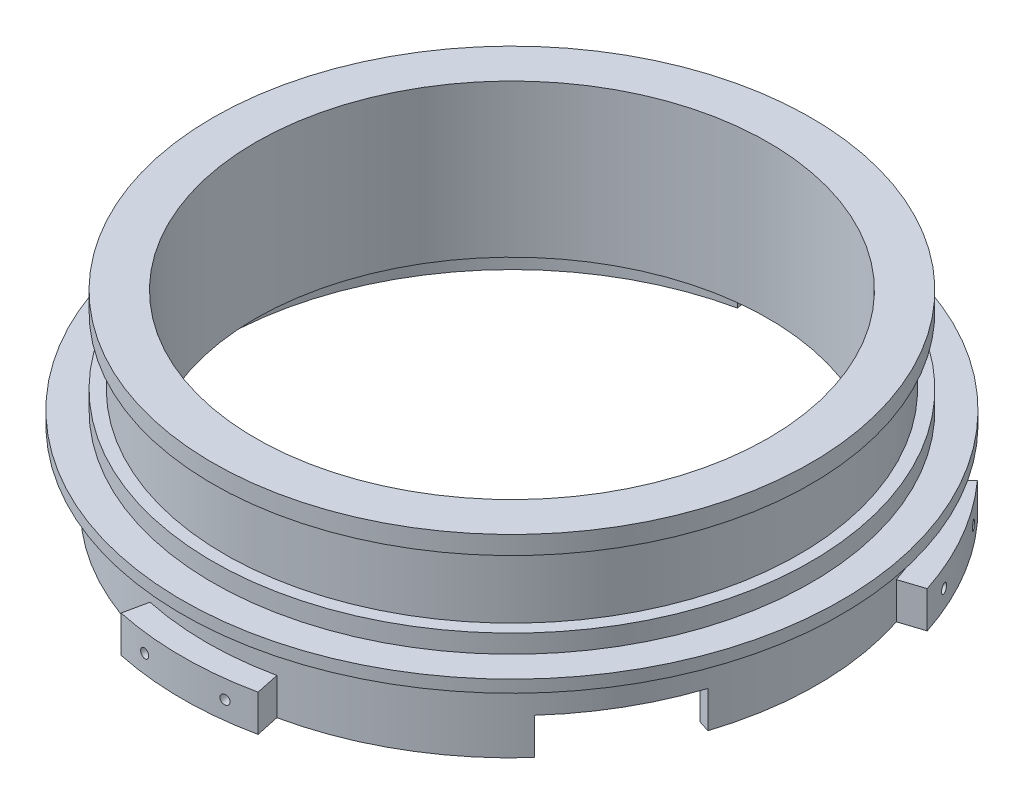
from build123d import *

# Parameters (mm, degrees)
CUT_EXTRUDE1_DEPTH                  = 6
CUT_EXTRUDE2_DEPTH                  = 6
CUT_EXTRUDE3_DEPTH                  = 6
BOSS_EXTRUDE1_DEPTH                 = 6
BOSS_EXTRUDE2_DEPTH                 = 6
BOSS_EXTRUDE3_DEPTH                 = 6
F_1_5MM_DOWEL_HOLE1_D               = 1.5
F_1_5MM_DOWEL_HOLE1_DEPTH           = 3
F_1_5MM_DOWEL_HOLE1_TIP             = 0.450645464
F_1_5MM_DOWEL_HOLE1_ON_FACE_2_D     = 1.5
F_1_5MM_DOWEL_HOLE1_ON_FACE_2_DEPTH = 3
F_1_5MM_DOWEL_HOLE1_ON_FACE_2_TIP   = 0.450645464
F_1_5MM_DOWEL_HOLE1_ON_FACE_3_D     = 1.5
F_1_5MM_DOWEL_HOLE1_ON_FACE_3_DEPTH = 3
F_1_5MM_DOWEL_HOLE1_ON_FACE_3_TIP   = 0.450645464
F_1_5MM_DOWEL_HOLE1_ON_FACE_4_D     = 1.5
F_1_5MM_DOWEL_HOLE1_ON_FACE_4_DEPTH = 3
F_1_5MM_DOWEL_HOLE1_ON_FACE_4_TIP   = 0.450645464
F_1_5MM_DOWEL_HOLE1_ON_FACE_5_D     = 1.5
F_1_5MM_DOWEL_HOLE1_ON_FACE_5_DEPTH = 3
F_1_5MM_DOWEL_HOLE1_ON_FACE_5_TIP   = 0.450645464
F_1_5MM_DOWEL_HOLE1_ON_FACE_6_D     = 1.5
F_1_5MM_DOWEL_HOLE1_ON_FACE_6_DEPTH = 3
F_1_5MM_DOWEL_HOLE1_ON_FACE_6_TIP   = 0.450645464


with BuildPart() as part:
    # Sketch1 → Revolve1 (revolve)
    with BuildSketch(Plane.XY):
        Polygon((-42, 6), (-42, 31), (-49, 31), (-49, 28), (-47, 28), (-47, 17), (-49, 17), (-49, 14), (-54, 14), (-54, 12), (-50, 12), (-50, 0), (-48, 0), (-48, 10), (-44, 10), (-44, 7), (-43, 6), align=None)
    revolve(axis=Axis((0, 15.855614973, 0), (0, -1, 0)))

    # Sketch2 → Cut-Extrude1 (cut)
    with BuildSketch(Plane.XZ):
        with BuildLine():
            Line((10.395584541, -48.907380037), (9.979761159, -46.951084835))
            ThreePointArc((9.979761159, -46.951084835), (0, -48), (-9.979761159, -46.951084835))
            Line((-9.979761159, -46.951084835), (-10.395584541, -48.907380037))
            ThreePointArc((-10.395584541, -48.907380037), (0, -50), (10.395584541, -48.907380037))
        make_face()
    extrude(amount=-CUT_EXTRUDE1_DEPTH, mode=Mode.SUBTRACT)

    # Sketch2<5> → Cut-Extrude2 (cut)
    with BuildSketch(Plane.XZ):
        with BuildLine():
            ThreePointArc((-45.650712782, 14.83281573), (-41.569219382, 24), (-35.670951623, 32.118269105))
            Line((-35.670951623, 32.118269105), (-37.157241274, 33.456530318))
            ThreePointArc((-37.157241274, 33.456530318), (-43.301270189, 25), (-47.552825815, 15.450849719))
            Line((-47.552825815, 15.450849719), (-45.650712782, 14.83281573))
        make_face()
    extrude(amount=-CUT_EXTRUDE2_DEPTH, mode=Mode.SUBTRACT)

    # Sketch2<6> → Cut-Extrude3 (cut)
    with BuildSketch(Plane.XZ):
        with BuildLine():
            Line((37.157241274, 33.456530318), (35.670951623, 32.118269105))
            ThreePointArc((35.670951623, 32.118269105), (41.569219382, 24), (45.650712782, 14.83281573))
            Line((45.650712782, 14.83281573), (47.552825815, 15.450849719))
            ThreePointArc((47.552825815, 15.450849719), (43.301270189, 25), (37.157241274, 33.456530318))
        make_face()
    extrude(amount=-CUT_EXTRUDE3_DEPTH, mode=Mode.SUBTRACT)

    # Sketch2<7> → Boss-Extrude1 (add)
    with BuildSketch(Plane.XZ):
        with BuildLine():
            ThreePointArc((47.552825815, -15.450849719), (43.301270189, -25), (37.157241274, -33.456530318))
            Line((37.157241274, -33.456530318), (40.129820576, -36.133052743))
            ThreePointArc((40.129820576, -36.133052743), (46.765371804, -27), (51.35705188, -16.686917696))
            Line((51.35705188, -16.686917696), (47.552825815, -15.450849719))
        make_face()
    extrude(amount=-BOSS_EXTRUDE1_DEPTH)

    # Sketch2<8> → Boss-Extrude2 (add)
    with BuildSketch(Plane.XZ):
        with BuildLine():
            ThreePointArc((-10.395584541, 48.907380037), (-5.226423163, 49.726094768), (0, 50))
            ThreePointArc((0, 50), (5.226423163, 49.726094768), (10.395584541, 48.907380037))
            Line((10.395584541, 48.907380037), (11.227231304, 52.81997044))
            ThreePointArc((11.227231304, 52.81997044), (0, 54), (-11.227231304, 52.81997044))
            Line((-11.227231304, 52.81997044), (-10.395584541, 48.907380037))
        make_face()
    extrude(amount=-BOSS_EXTRUDE2_DEPTH)

    # Sketch2<9> → Boss-Extrude3 (add)
    with BuildSketch(Plane.XZ):
        with BuildLine():
            Line((-40.129820576, -36.133052743), (-37.157241274, -33.456530318))
            ThreePointArc((-37.157241274, -33.456530318), (-43.301270189, -25), (-47.552825815, -15.450849719))
            Line((-47.552825815, -15.450849719), (-51.35705188, -16.686917696))
            ThreePointArc((-51.35705188, -16.686917696), (-46.765371804, -27), (-40.129820576, -36.133052743))
        make_face()
    extrude(amount=-BOSS_EXTRUDE3_DEPTH)

    # Ø1.5mm Dowel Hole1
    with Locations(Plane(origin=(6.577263108, 3, 53.597944084), x_dir=(0.992554520069, 0, -0.121801168675), z_dir=(0.121801168675, 0, 0.992554520069))):
        with Locations((0, 0)):
            Hole(F_1_5MM_DOWEL_HOLE1_D / 2, depth=F_1_5MM_DOWEL_HOLE1_DEPTH)
            with Locations((0, 0, -(F_1_5MM_DOWEL_HOLE1_DEPTH + F_1_5MM_DOWEL_HOLE1_TIP / 2))):  # 118° drill point
                Cone(0, F_1_5MM_DOWEL_HOLE1_D / 2, F_1_5MM_DOWEL_HOLE1_TIP, mode=Mode.SUBTRACT)

    # Ø1.5mm Dowel Hole1 on face 2
    with Locations(Plane(origin=(-6.584625948, 3, 53.597040041), x_dir=(0.992537723435, 0, 0.121937966023), z_dir=(-0.121937966023, 0, 0.992537723435))):
        with Locations((0, 0)):
            Hole(F_1_5MM_DOWEL_HOLE1_ON_FACE_2_D / 2, depth=F_1_5MM_DOWEL_HOLE1_ON_FACE_2_DEPTH)
            with Locations((0, 0, -(F_1_5MM_DOWEL_HOLE1_ON_FACE_2_DEPTH + F_1_5MM_DOWEL_HOLE1_ON_FACE_2_TIP / 2))):  # 118° drill point
                Cone(0, F_1_5MM_DOWEL_HOLE1_ON_FACE_2_D / 2, F_1_5MM_DOWEL_HOLE1_ON_FACE_2_TIP, mode=Mode.SUBTRACT)

    # Ø1.5mm Dowel Hole1 on face 3
    with Locations(Plane(origin=(-49.705812721, 3, -21.102895103), x_dir=(0.39079405883, 0, -0.920478138569), z_dir=(-0.920478138569, 0, -0.39079405883))):
        with Locations((-1e-09, 0)):
            Hole(F_1_5MM_DOWEL_HOLE1_ON_FACE_3_D / 2, depth=F_1_5MM_DOWEL_HOLE1_ON_FACE_3_DEPTH)
            with Locations((0, 0, -(F_1_5MM_DOWEL_HOLE1_ON_FACE_3_DEPTH + F_1_5MM_DOWEL_HOLE1_ON_FACE_3_TIP / 2))):  # 118° drill point
                Cone(0, F_1_5MM_DOWEL_HOLE1_ON_FACE_3_D / 2, F_1_5MM_DOWEL_HOLE1_ON_FACE_3_TIP, mode=Mode.SUBTRACT)

    # Ø1.5mm Dowel Hole1 on face 4
    with Locations(Plane(origin=(-43.124085269, 3, -32.500973366), x_dir=(0.601870037997, 0, -0.798594050417), z_dir=(-0.798594050417, 0, -0.601870037997))):
        with Locations((0, 0)):
            Hole(F_1_5MM_DOWEL_HOLE1_ON_FACE_4_D / 2, depth=F_1_5MM_DOWEL_HOLE1_ON_FACE_4_DEPTH)
            with Locations((0, 0, -(F_1_5MM_DOWEL_HOLE1_ON_FACE_4_DEPTH + F_1_5MM_DOWEL_HOLE1_ON_FACE_4_TIP / 2))):  # 118° drill point
                Cone(0, F_1_5MM_DOWEL_HOLE1_ON_FACE_4_D / 2, F_1_5MM_DOWEL_HOLE1_ON_FACE_4_TIP, mode=Mode.SUBTRACT)

    # Ø1.5mm Dowel Hole1 on face 5
    with Locations(Plane(origin=(43.128549613, 3, -32.495048981), x_dir=(0.601759985579, 0, 0.79867698086), z_dir=(0.79867698086, 0, -0.601759985579))):
        with Locations((0, 0)):
            Hole(F_1_5MM_DOWEL_HOLE1_ON_FACE_5_D / 2, depth=F_1_5MM_DOWEL_HOLE1_ON_FACE_5_DEPTH)
            with Locations((0, 0, -(F_1_5MM_DOWEL_HOLE1_ON_FACE_5_DEPTH + F_1_5MM_DOWEL_HOLE1_ON_FACE_5_TIP / 2))):  # 118° drill point
                Cone(0, F_1_5MM_DOWEL_HOLE1_ON_FACE_5_D / 2, F_1_5MM_DOWEL_HOLE1_ON_FACE_5_TIP, mode=Mode.SUBTRACT)

    # Ø1.5mm Dowel Hole1 on face 6
    with Locations(Plane(origin=(49.708711217, 3, -21.096066675), x_dir=(0.39066787318, 0, 0.920531701173), z_dir=(0.920531701173, 0, -0.39066787318))):
        with Locations((0, 0)):
            Hole(F_1_5MM_DOWEL_HOLE1_ON_FACE_6_D / 2, depth=F_1_5MM_DOWEL_HOLE1_ON_FACE_6_DEPTH)
            with Locations((0, 0, -(F_1_5MM_DOWEL_HOLE1_ON_FACE_6_DEPTH + F_1_5MM_DOWEL_HOLE1_ON_FACE_6_TIP / 2))):  # 118° drill point
                Cone(0, F_1_5MM_DOWEL_HOLE1_ON_FACE_6_D / 2, F_1_5MM_DOWEL_HOLE1_ON_FACE_6_TIP, mode=Mode.SUBTRACT)


solid = part.part
